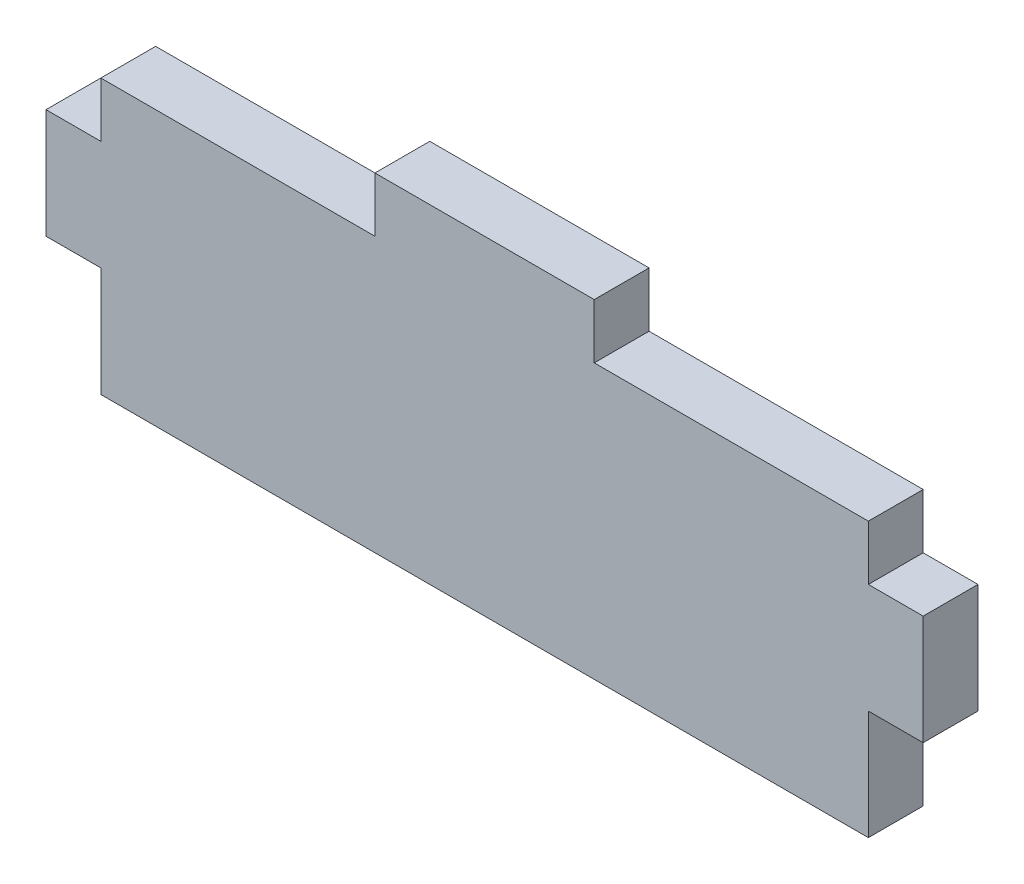
from build123d import *

# Parameters (mm, degrees)
SKETCH1_W           = 88.9
SKETCH1_H           = 31.75
SKETCH1_W_2         = 25.4
SKETCH1_H_2         = 6.35
SKETCH1_W_3         = 6.35
SKETCH1_H_3         = 12.7
BOSS_EXTRUDE1_DEPTH = 6.35


with BuildPart() as part:
    # Sketch1 → Boss-Extrude1 (new body)
    with BuildSketch(Plane.XY):
        with Locations((39.333678216, 3.176893638)):
            Rectangle(SKETCH1_W, SKETCH1_H)
        with Locations((39.333678216, 22.226893638)):
            Rectangle(SKETCH1_W_2, SKETCH1_H_2)
        Polygon((90.133678216, 0.001893638), (90.133678216, 9.319008236), (90.133678216, 12.701893638), (83.783678216, 12.701893638), (83.783678216, 0.001893638), align=None)
        with Locations((-8.291321784, 6.351893638)):
            Rectangle(SKETCH1_W_3, SKETCH1_H_3)
    extrude(amount=BOSS_EXTRUDE1_DEPTH)


solid = part.part
